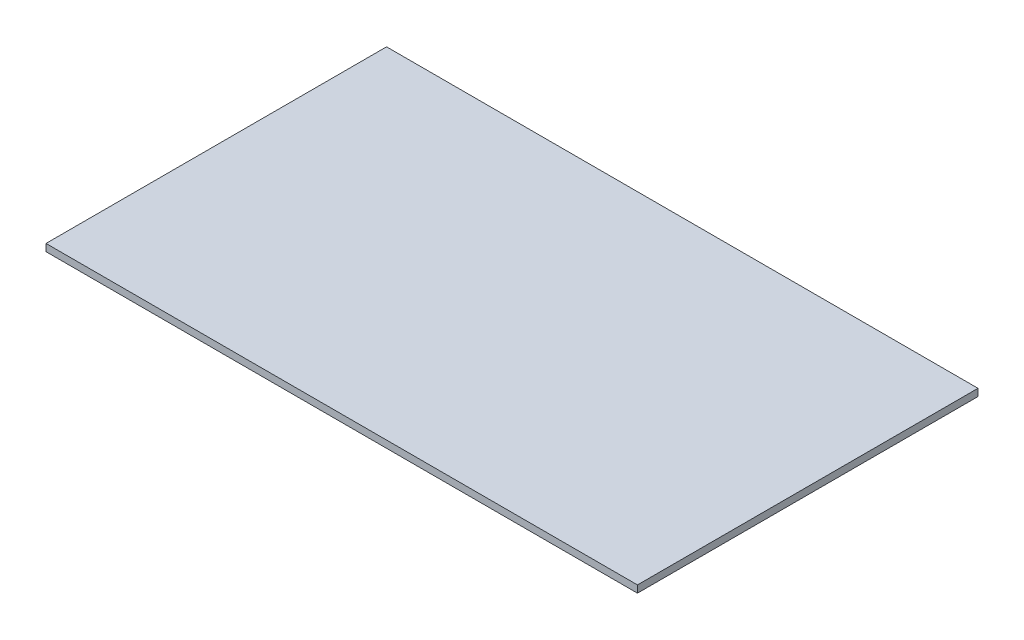
from build123d import *

# Parameters (mm, degrees)
SKETCH1_W           = 82.5
SKETCH1_H           = 47.5
BOSS_EXTRUDE1_DEPTH = 1


with BuildPart() as part:
    # Sketch1 → Boss-Extrude1 (new body)
    with BuildSketch(Plane(origin=(0, 0, 0), x_dir=(1, 0, 0), z_dir=(0, 1, 0))):
        with Locations((41.25, -23.75)):
            Rectangle(SKETCH1_W, SKETCH1_H)
    extrude(amount=BOSS_EXTRUDE1_DEPTH)


solid = part.part
